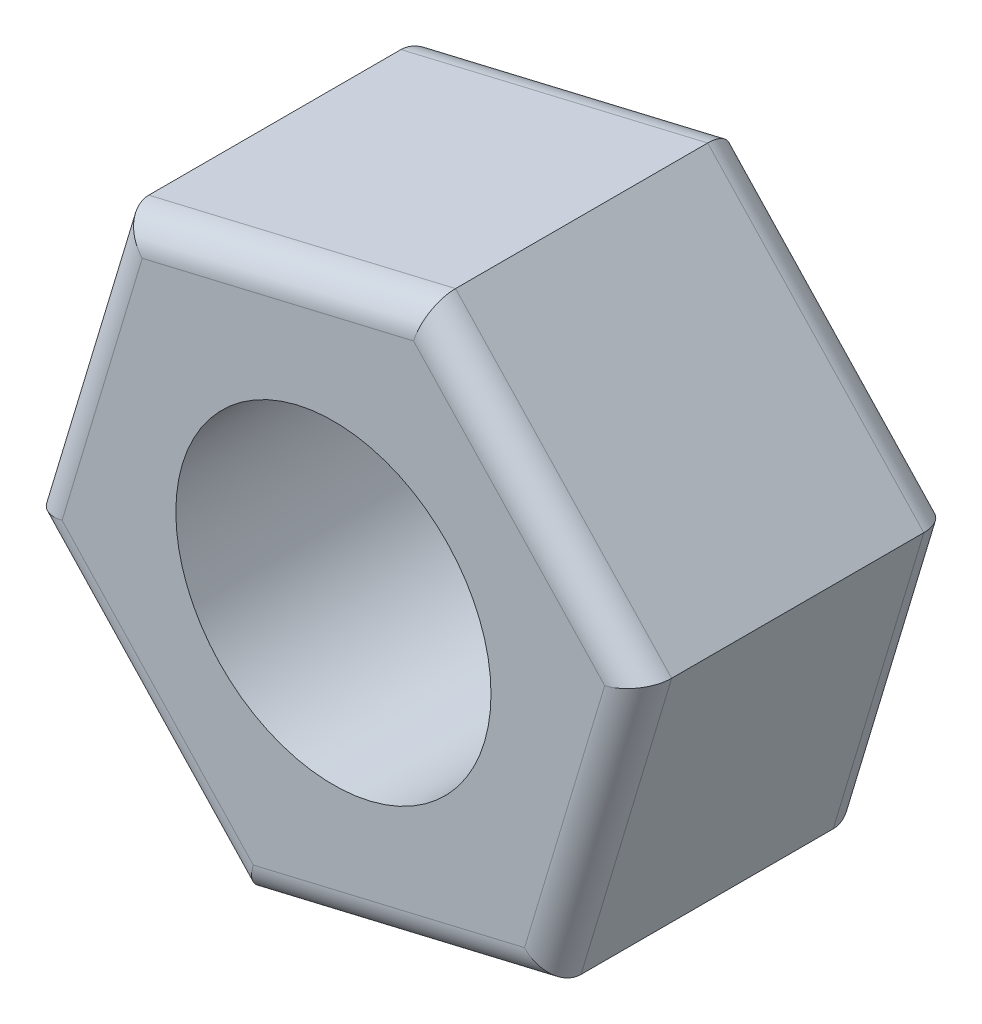
from build123d import *

# Parameters (mm, degrees)
SKETCH_1_R      = 5
EXTRUDE_1_DEPTH = 10
FILLET_1_R      = 1


with BuildPart() as part:
    # Эскиз1 → Вытянуть1 (new body)
    with BuildSketch(Plane.XY):
        Polygon((9.732299753, 2.298334508), (2.875733806, 9.577586078), (-6.856565947, 7.27925157), (-9.732299753, -2.298334508), (-2.875733806, -9.577586078), (6.856565947, -7.27925157), align=None)
        Circle(SKETCH_1_R, mode=Mode.SUBTRACT)
    extrude(amount=EXTRUDE_1_DEPTH)

    # Скругление1
    fillet_1_edges = [part.edges().sort_by_distance(p)[0] for p in [
        (-1.99041607, 8.428418824, 10),
        (-8.29443285, 2.490458531, 10),
        (-6.30401678, -5.937960293, 10),
        (1.99041607, -8.428418824, 10),
        (8.29443285, -2.490458531, 10),
        (1.99041607, -8.428418824, 0),
        (-6.30401678, -5.937960293, 0),
        (-8.29443285, 2.490458531, 0),
        (6.30401678, 5.937960293, 10),
        (-1.99041607, 8.428418824, 0),
        (6.30401678, 5.937960293, 0),
        (8.29443285, -2.490458531, 0),
    ]]
    fillet(fillet_1_edges, radius=FILLET_1_R)


solid = part.part
